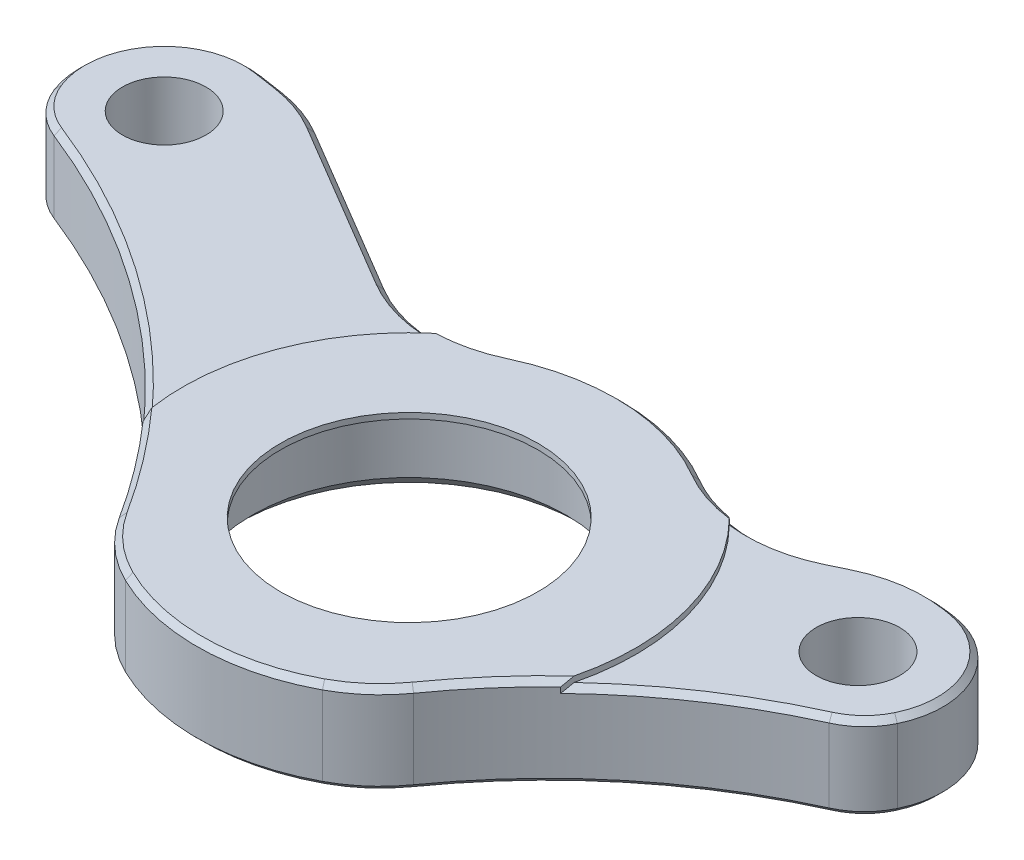
from build123d import *
from build123d.topology import SkipClean

# Parameters (mm, degrees)
SKETCH1_R           = 11.1
SKETCH1_R_2         = 2.95
BOSS_EXTRUDE1_DEPTH = 6.4
CUT_EXTRUDE4_REACH  = 48.556
CHAMFER1_SIZE       = 1
CUT_EXTRUDE3_DEPTH  = 47.555734529
FILLET1_R           = 10
FILLET2_R           = 5
SKETCH7_R           = 11.1
SKETCH7_R_2         = 9.1
BOSS_EXTRUDE2_DEPTH = 0.4
SKETCH9_OUTSIDE_W   = 87.68
SKETCH9_OUTSIDE_H   = 55.695
SKETCH9_OUTSIDE_R   = 16
CUT_EXTRUDE5_DEPTH  = 0.4
CUT_EXTRUDE6_DEPTH  = 0.15
CHAMFER2_SIZE       = 0.4


with BuildPart() as part:
    # Sketch1 → Boss-Extrude1 (new body)
    with BuildSketch(Plane(origin=(0, 0, 0), x_dir=(1, 0, 0), z_dir=(0, 1, 0))):
        with BuildLine():
            Line((-9.621787606, -11.507441213), (-37.944538575, 12.174234774))
            ThreePointArc((-37.944538575, 12.174234774), (-39.566706632, 19.240834224), (-33.200130557, 22.709979086))
            Line((-33.200130557, 22.709979086), (24.561921844, 13.989417946))
            ThreePointArc((24.561921844, 13.989417946), (29.443583706, 9.675962035), (27.514943911, 3.453673633))
            Line((27.514943911, 3.453673633), (9.621787606, -11.507441213))
            ThreePointArc((9.621787606, -11.507441213), (0, -15), (-9.621787606, -11.507441213))
        make_face()
        with Locations(Location((0, 0, 0), (0, 0, 270))):
            Circle(SKETCH1_R, mode=Mode.SUBTRACT)
        with Locations(Location((-34.095823533, 16.777211259, 0), (0, 0, 270))):
            Circle(SKETCH1_R_2, mode=Mode.SUBTRACT)
        with Locations(Location((23.666228869, 8.056650118, 0), (0, 0, 270))):
            Circle(SKETCH1_R_2, mode=Mode.SUBTRACT)
    extrude(amount=BOSS_EXTRUDE1_DEPTH)

    # Sketch6 → Cut-Extrude4 (cut, up to next)
    with BuildSketch(Plane(origin=(0, 6.4, 0), x_dir=(1, 0, 0), z_dir=(0, 1, 0)), mode=Mode.PRIVATE) as cut_extrude4_sk1:
        with BuildLine():
            Line((-10.397549699, 10.811612287), (-29.542980034, 22.157844884))
            Line((-29.542980034, 22.157844884), (21.066082003, 14.517198449))
            Line((21.066082003, 14.517198449), (11.313303216, 9.849323344))
            ThreePointArc((11.313303216, 9.849323344), (0.664192087, 14.985287747), (-10.397549699, 10.811612287))
        make_face()
    cut_extrude4_tool1 = extrude(cut_extrude4_sk1.sketch, amount=-CUT_EXTRUDE4_REACH, mode=Mode.PRIVATE) & part.part
    add(cut_extrude4_tool1.solids().sort_by_distance((-4.90649, 6.4, -15.955418))[0], mode=Mode.SUBTRACT)

    # Chamfer1
    chamfer1_edges = [part.edges().sort_by_distance(p)[0] for p in [
        (0, 6.4, -11.1),
    ]]
    chamfer(chamfer1_edges, length=CHAMFER1_SIZE)

    # Sketch5 → Cut-Extrude3 (cut, through all)
    with BuildSketch(Plane(origin=(0, 6.4, 0), x_dir=(1, 0, 0), z_dir=(0, 1, 0))):
        with BuildLine():
            Line((-37.944538575, 12.174234774), (-9.621787606, -11.507441213))
            ThreePointArc((-9.621787606, -11.507441213), (-21.736768022, 2.78083918), (-37.944538575, 12.174234774))
        make_face()
        with BuildLine():
            Line((9.621787606, -11.507441213), (27.514943911, 3.453673633))
            ThreePointArc((27.514943911, 3.453673633), (17.45368355, -2.69374898), (9.621787606, -11.507441213))
        make_face()
    extrude(amount=-CUT_EXTRUDE3_DEPTH, mode=Mode.SUBTRACT)

    # Fillet1
    fillet1_edges = [part.edges().sort_by_distance(p)[0] for p in [
        (-9.621787606, 3.2, 11.507441213),
        (9.621787606, 3.2, 11.507441213),
        (11.313303216, 3.2, -9.849323344),
        (-10.397549699, 3.2, -10.811612287),
        (-29.542980034, 3.2, -22.157844884),
        (21.066082003, 3.2, -14.517198449),
    ]]
    fillet(fillet1_edges, radius=FILLET1_R)

    # Fillet2
    fillet2_edges = [part.edges().sort_by_distance(p)[0] for p in [
        (-37.944538575, 3.2, -12.174234774),
        (27.514943911, 3.2, -3.453673633),
    ]]
    fillet(fillet2_edges, radius=FILLET2_R)

    # Sketch7 → Boss-Extrude2 (add)
    with BuildSketch(Plane.XZ):
        with Locations(Location((0, 0, 0), (0, 0, 270))):
            Circle(SKETCH7_R)
        with Locations(Location((0, 0, 0), (0, 0, 270))):
            Circle(SKETCH7_R_2, mode=Mode.SUBTRACT)
    extrude(amount=-BOSS_EXTRUDE2_DEPTH)

    # Sketch9 outside → Cut-Extrude5 (cut)
    with BuildSketch(Plane.XZ):
        with Locations((-5.215, -3.8885)):
            Rectangle(SKETCH9_OUTSIDE_W, SKETCH9_OUTSIDE_H)
        Circle(SKETCH9_OUTSIDE_R, mode=Mode.SUBTRACT)
    extrude(amount=-CUT_EXTRUDE5_DEPTH, mode=Mode.SUBTRACT)

    # Sketch10 → Cut-Extrude6 (cut)
    with SkipClean():  # the faces are left unmerged after this step: merging them gives an invalid solid
        with BuildSketch(Plane.XZ.offset(-0.4)):
            with BuildLine():
                Line((-33.200130557, -22.709979086), (-31.471010975, -22.448927195))
                ThreePointArc((-31.471010975, -22.448927195), (-29.606213483, -21.980449689), (-27.865545183, -21.16373999))
                Line((-27.865545183, -21.16373999), (-15.778990975, -14.000837254))
                ThreePointArc((-15.778990975, -14.000837254), (-12.899787471, -12.852921242), (-9.807384948, -12.641803688))
                ThreePointArc((-9.807384948, -12.641803688), (-14.988647226, -5.59825458), (-15.693394103, 3.11727149))
                ThreePointArc((-15.693394103, 3.11727149), (-25.389120558, -5.583543581), (-36.859243696, -11.759915461))
                ThreePointArc((-36.859243696, -11.759915461), (-38.564746422, -12.878937509), (-39.681392394, -14.585996871))
                ThreePointArc((-39.681392394, -14.585996871), (-38.786079998, -20.519068323), (-33.200130557, -22.709979086))
            make_face()
        extrude(amount=-CUT_EXTRUDE6_DEPTH, mode=Mode.SUBTRACT)

    # Chamfer2
    chamfer2_edges = [part.edges().sort_by_distance(p)[0] for p in [
        (9.181258422, 0, -12.186693797),
        (0.664192087, 0, -14.985287747),
        (-8.067073348, 0, -12.95119066),
        (12.787484872, 0, 7.295073573),
        (8.973593298, 0, 11.909370886),
        (0.284328537, 0, 14.997305001),
        (-8.853535866, 0, 11.952551059),
        (-13.030899461, 0, 6.394129067),
        (-8.853535866, 6.4, 11.952551059),
        (0.284328537, 6.4, 14.997305001),
        (-22.030616875, 6.4, -3.024808286),
        (8.973593298, 6.4, 11.909370886),
        (-38.564746422, 6.4, -12.878937509),
        (17.688730274, 6.4, 2.498737743),
        (-38.786079998, 6.4, -20.519068323),
        (28.054256045, 6.4, -4.038174832),
        (-32.335570766, 6.4, -22.579453141),
        (28.974894193, 6.4, -10.852731747),
        (-29.606213483, 6.4, -21.980449689),
        (24.33317404, 6.4, -14.023952889),
        (-21.822268079, 6.4, -17.582288622),
        (21.134254432, 6.4, -14.06081124),
        (-11.148337367, 6.4, -12.614536482),
        (17.625106381, 6.4, -12.870278654),
        (0.664192087, 6.4, -14.985287747),
        (12.220655249, 6.4, -11.578753904),
        (13.986327713, 0.4, -11.661249433),
        (17.625106381, 0.4, -12.870278654),
        (21.134254432, 0.4, -14.06081124),
        (20.643800798, 0.4, 0.286607853),
        (24.33317404, 0.4, -14.023952889),
        (28.054256045, 0.4, -4.038174832),
        (28.974894193, 0.4, -10.852731747),
        (-25.389120558, 0.55, -5.583543581),
        (-38.564746422, 0.55, -12.878937509),
        (-38.786079998, 0.55, -20.519068323),
        (-32.335570766, 0.55, -22.579453141),
        (-29.606213483, 0.55, -21.980449689),
        (-12.899787471, 0.55, -12.852921242),
        (-21.822268079, 0.55, -17.582288622),
    ]]
    chamfer(chamfer2_edges, length=CHAMFER2_SIZE)


with BuildPart() as body_2:
    # Mirror1: mirrored copy
    add(part.part.mirror(Plane.ZX))


solid = body_2.part
